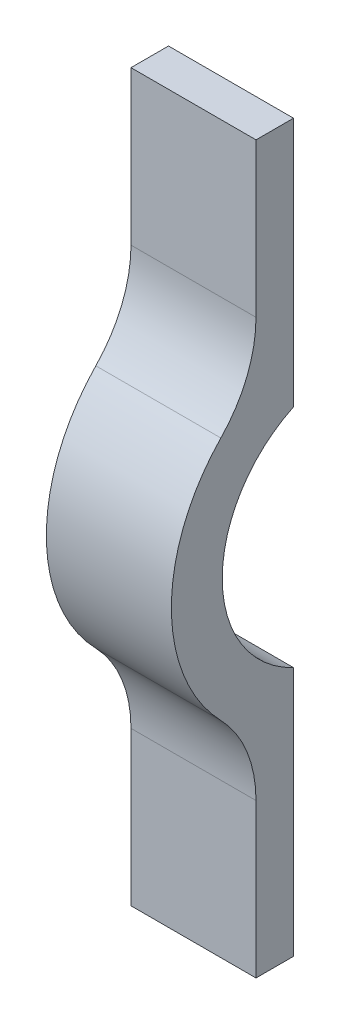
from build123d import *

# Parameters (mm, degrees)
EXTRUDE_1_DEPTH = 10
FILLET_1_R      = 10


with BuildPart() as part:
    # 草图1 → 凸台-拉伸1 (new body)
    with BuildSketch(Plane(origin=(0, 0, 0), x_dir=(0, 0, -1), z_dir=(1, 0, 0))):
        with BuildLine():
            Line((-4.3, 9.028288874), (-4.3, 29.028288874))
            Line((-4.3, 29.028288874), (-7.3, 29.028288874))
            Line((-7.3, 29.028288874), (-7.3, 12.028288874))
            ThreePointArc((-7.3, 12.028288874), (-12.261361814, 6.901357817), (-14.070171756, 0))
            Line((-14.070171756, 0), (-10, 0))
            ThreePointArc((-10, 0), (-8.455767263, 5.338539126), (-4.3, 9.028288874))
        make_face()
    extrude_1 = extrude(amount=EXTRUDE_1_DEPTH)

    # 镜向1: 凸台-拉伸1 across plane
    add(extrude_1.mirror(Plane(origin=(10, 0, 14.070171756), x_dir=(0, 0, 1), z_dir=(0, 1, 0))))

    # 圆角1
    fillet_1_edges = [part.edges().sort_by_distance(p)[0] for p in [
        (5, 12.028288874, 7.3),
        (5, -12.028288874, 7.3),
    ]]
    fillet(fillet_1_edges, radius=FILLET_1_R)


solid = part.part
